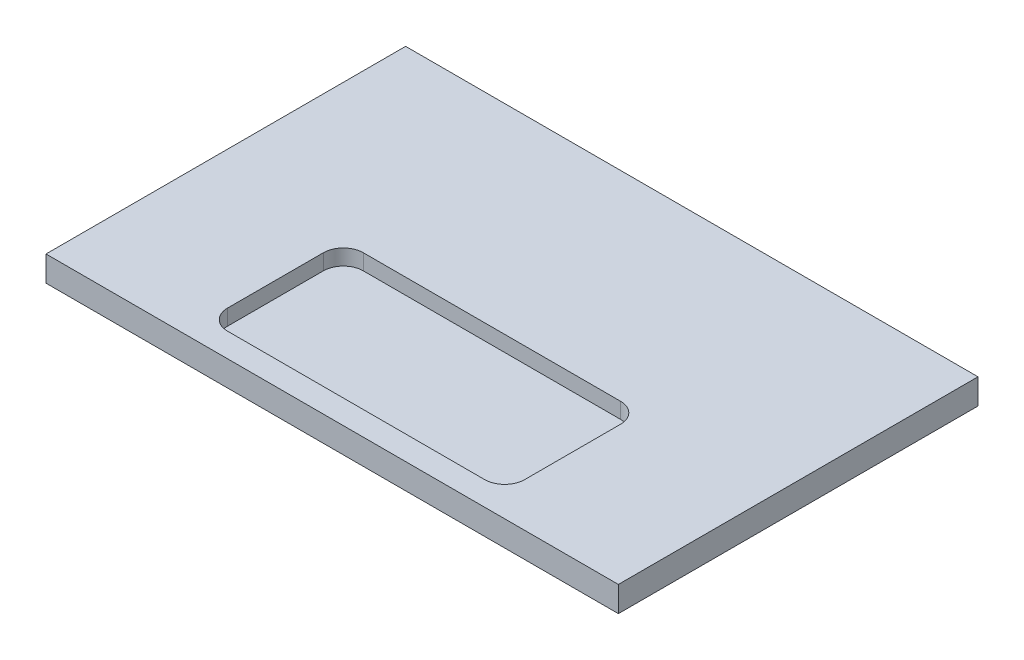
from build123d import *

# Parameters (mm, degrees)
SKETCH1_W           = 287.02
SKETCH1_H           = 180.34
BOSS_EXTRUDE3_DEPTH = 12.7
SKETCH3_W           = 149
SKETCH3_H           = 68.1
CUT_EXTRUDE1_DEPTH  = 7.874
FILLET1_R           = 10


with BuildPart() as part:
    # Sketch1 → Boss-Extrude3 (new body)
    with BuildSketch(Plane(origin=(0, 0, 0), x_dir=(1, 0, 0), z_dir=(0, 1, 0))):
        with Locations((-48.686752827, -78.346074313)):
            Rectangle(SKETCH1_W, SKETCH1_H)
    extrude(amount=BOSS_EXTRUDE3_DEPTH)

    # Sketch3 → Cut-Extrude1 (cut)
    with BuildSketch(Plane(origin=(0, 12.7, 0), x_dir=(1, 0, 0), z_dir=(0, 1, 0))):
        with Locations((-48.686752827, -122.466074313)):
            Rectangle(SKETCH3_W, SKETCH3_H)
    extrude(amount=-CUT_EXTRUDE1_DEPTH, mode=Mode.SUBTRACT)

    # Fillet1
    fillet1_edges = [part.edges().sort_by_distance(p)[0] for p in [
        (25.813247173, 8.763, 156.516074313),
        (-123.186752827, 8.763, 156.516074313),
        (-123.186752827, 8.763, 88.416074313),
        (25.813247173, 8.763, 88.416074313),
    ]]
    fillet(fillet1_edges, radius=FILLET1_R)


solid = part.part
